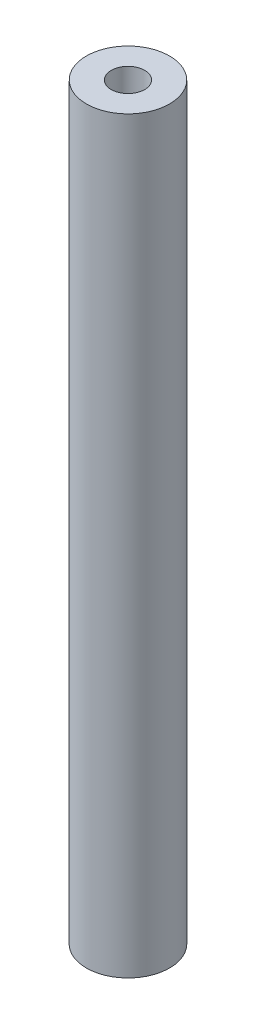
from build123d import *

# Parameters (mm, degrees)
SKETCH1_R                   = 6.35
BOSS_EXTRUDE1_DEPTH         = 114.3
F_1_4_20_TAPPED_HOLE1_D     = 5.1054
F_1_4_20_TAPPED_HOLE1_DEPTH = 16.51
F_1_4_20_TAPPED_HOLE1_TIP   = 1.533816902


with BuildPart() as part:
    # Sketch1 → Boss-Extrude1 (new body)
    with BuildSketch(Plane(origin=(0, 0, 0), x_dir=(1, 0, 0), z_dir=(0, 1, 0))):
        with Locations(Location((0, 0, 0), (0, 0, 270))):
            Circle(SKETCH1_R)
    extrude(amount=BOSS_EXTRUDE1_DEPTH)

    # 1/4-20 Tapped Hole1
    with Locations(Plane(origin=(0, 114.3, 0), x_dir=(1, 0, 0), z_dir=(0, 1, 0))):
        with Locations((0, 0)):
            Hole(F_1_4_20_TAPPED_HOLE1_D / 2, depth=F_1_4_20_TAPPED_HOLE1_DEPTH)
            with Locations((0, 0, -(F_1_4_20_TAPPED_HOLE1_DEPTH + F_1_4_20_TAPPED_HOLE1_TIP / 2))):  # 118° drill point
                Cone(0, F_1_4_20_TAPPED_HOLE1_D / 2, F_1_4_20_TAPPED_HOLE1_TIP, mode=Mode.SUBTRACT)


solid = part.part
